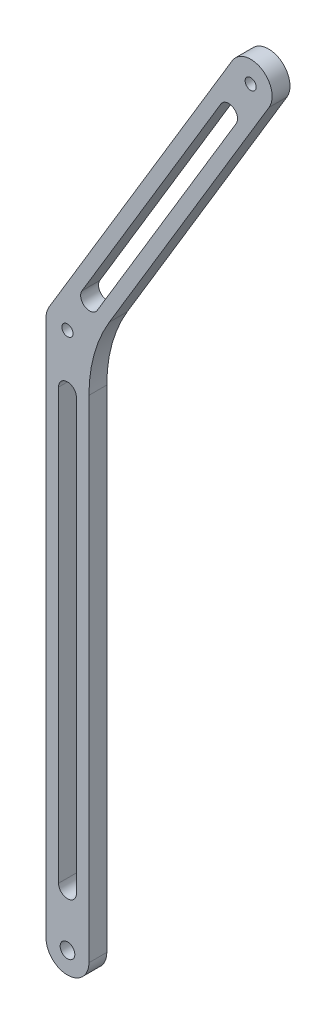
from build123d import *

# Parameters (mm, degrees)
SKETCH_1_R          = 6
SKETCH_1_R_2        = 2.05
SKETCH_1_R_3        = 1.55
EXTRUDE_1_DEPTH     = 5
FILLET_1_R          = 40
CUT_EXTRUDE_1_DEPTH = 249.231362274
CUT_EXTRUDE_2_DEPTH = 249.231362274


with BuildPart() as part:
    # 草图1 → 凸台-拉伸1 (new body)
    # profile 1 of 6: a face of its own
    with BuildSketch(Plane.XY):
        with BuildLine():
            Line((6, 0), (6, 148.536084387))
            Line((6, 148.536084387), (5.143034079, 147.109821936))
            ThreePointArc((5.143034079, 147.109821936), (-1.603401935, 144.418209427), (-6, 150.2))
            Line((-6, 150.2), (-6, 0))
            ThreePointArc((-6, 0), (0, 6), (6, 0))
        make_face()
    # profile 2 of 6: a face of its own
    with BuildSketch(Plane.XY):
        Circle(SKETCH_1_R)
        Circle(SKETCH_1_R_2, mode=Mode.SUBTRACT)
    # profile 3 of 6: a face of its own
    with BuildSketch(Plane.XY):
        with BuildLine():
            Line((6, 148.536084387), (56.388486973, 232.398470405))
            ThreePointArc((56.388486973, 232.398470405), (48.155274831, 230.34561439), (46.102418816, 238.578826533))
            Line((46.102418816, 238.578826533), (-5.143034079, 153.290178064))
            ThreePointArc((-5.143034079, 153.290178064), (1.603401935, 155.981790573), (6, 150.2))
            Line((6, 150.2), (6, 148.536084387))
        make_face()
    # profile 4 of 6: a face of its own
    with BuildSketch(Plane.XY):
        with Locations((51.245452895, 235.488648469)):
            Circle(SKETCH_1_R)
        with Locations((51.245452895, 235.488648469)):
            Circle(SKETCH_1_R_3, mode=Mode.SUBTRACT)
    # profile 5 of 6: a face of its own
    with BuildSketch(Plane.XY):
        with Locations((0, 150.2)):
            Circle(SKETCH_1_R)
        with Locations((0, 150.2)):
            Circle(SKETCH_1_R_3, mode=Mode.SUBTRACT)
    # profile 6 of 6: a face of its own
    with BuildSketch(Plane.XY):
        with BuildLine():
            Line((5.143034079, 147.109821936), (6, 148.536084387))
            Line((6, 148.536084387), (6, 150.2))
            ThreePointArc((6, 150.2), (5.781790573, 148.596598065), (5.143034079, 147.109821936))
        make_face()
    extrude(amount=EXTRUDE_1_DEPTH)

    # 圆角1
    fillet_1_edges = [part.edges().sort_by_distance(p)[0] for p in [
        (6, 148.536084387, 2.5),
    ]]
    fillet(fillet_1_edges, radius=FILLET_1_R)

    # 草图3 → 切除-拉伸1 (cut, through all)
    with BuildSketch(Plane.XY.offset(5)):
        with BuildLine():
            Line((2.5, 135.2), (2.5, 15))
            ThreePointArc((2.5, 15), (0, 12.5), (-2.5, 15))
            Line((-2.5, 15), (-2.5, 135.2))
            ThreePointArc((-2.5, 135.2), (0, 137.7), (2.5, 135.2))
        make_face()
    extrude(amount=-CUT_EXTRUDE_1_DEPTH, mode=Mode.SUBTRACT)

    # 草图4 → 切除-拉伸2 (cut, through all)
    with BuildSketch(Plane.XY.offset(5)):
        with BuildLine():
            Line((47.208027633, 223.915006118), (8.323286994, 159.198493964))
            ThreePointArc((8.323286994, 159.198493964), (4.892781935, 158.343137291), (4.037425262, 161.77364235))
            Line((4.037425262, 161.77364235), (42.922165901, 226.490154505))
            ThreePointArc((42.922165901, 226.490154505), (46.35267096, 227.345511178), (47.208027633, 223.915006118))
        make_face()
    extrude(amount=-CUT_EXTRUDE_2_DEPTH, mode=Mode.SUBTRACT)


solid = part.part
